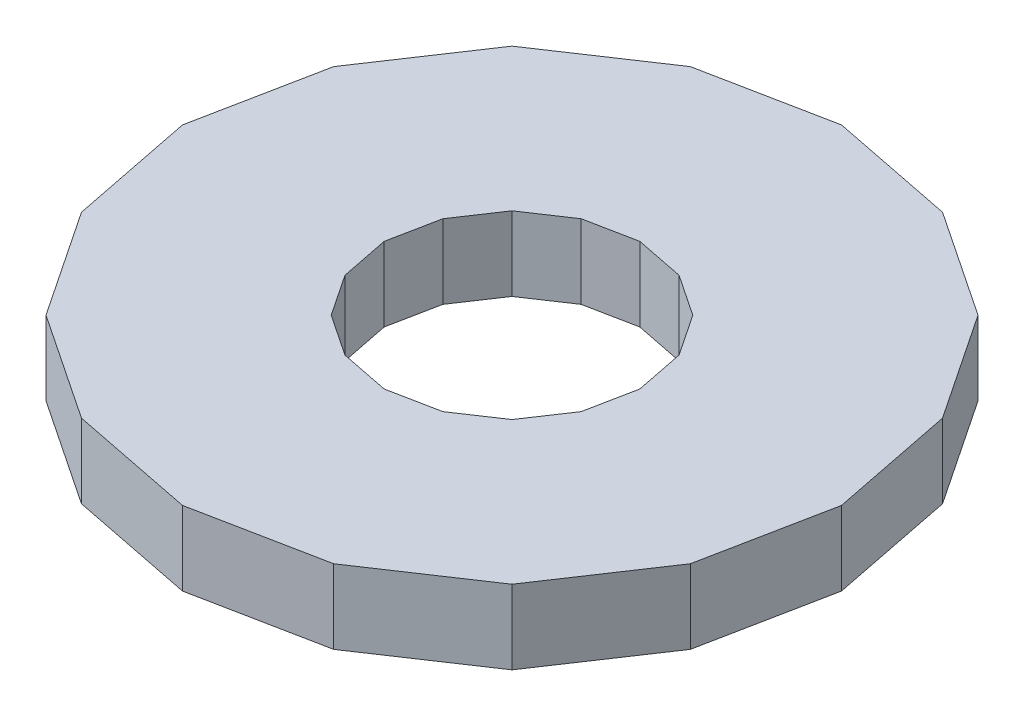
from build123d import *

# Parameters (mm, degrees)
BOSS_EXTRUDE1_DEPTH = 19.05


with BuildPart() as part:
    # Sketch1 → Boss-Extrude1 (new body)
    with BuildSketch(Plane(origin=(0, 0, 0), x_dir=(1, 0, 0), z_dir=(0, 1, 0))):
        Polygon((84.627468084, 0), (78.185585651, 32.385529959), (59.840656557, 59.840656557), (32.385529959, 78.185585651), (0, 84.627468084), (-32.385529959, 78.185585651), (-59.840656557, 59.840656557), (-78.185585651, 32.385529959), (-84.627468084, 0), (-78.185585651, -32.385529959), (-59.840656557, -59.840656557), (-32.385529959, -78.185585651), (0, -84.627468084), (32.385529959, -78.185585651), (59.840656557, -59.840656557), (78.185585651, -32.385529959), align=None)
        Polygon((32.832237247, 0), (30.333031999, 12.564353242), (23.215897599, 23.215897599), (12.564353242, 30.333031999), (0, 32.832237247), (-12.564353242, 30.333031999), (-23.215897599, 23.215897599), (-30.333031999, 12.564353242), (-32.832237247, 0), (-30.333031999, -12.564353242), (-23.215897599, -23.215897599), (-12.564353242, -30.333031999), (0, -32.832237247), (12.564353242, -30.333031999), (23.215897599, -23.215897599), (30.333031999, -12.564353242), align=None, mode=Mode.SUBTRACT)
    extrude(amount=BOSS_EXTRUDE1_DEPTH)


solid = part.part
